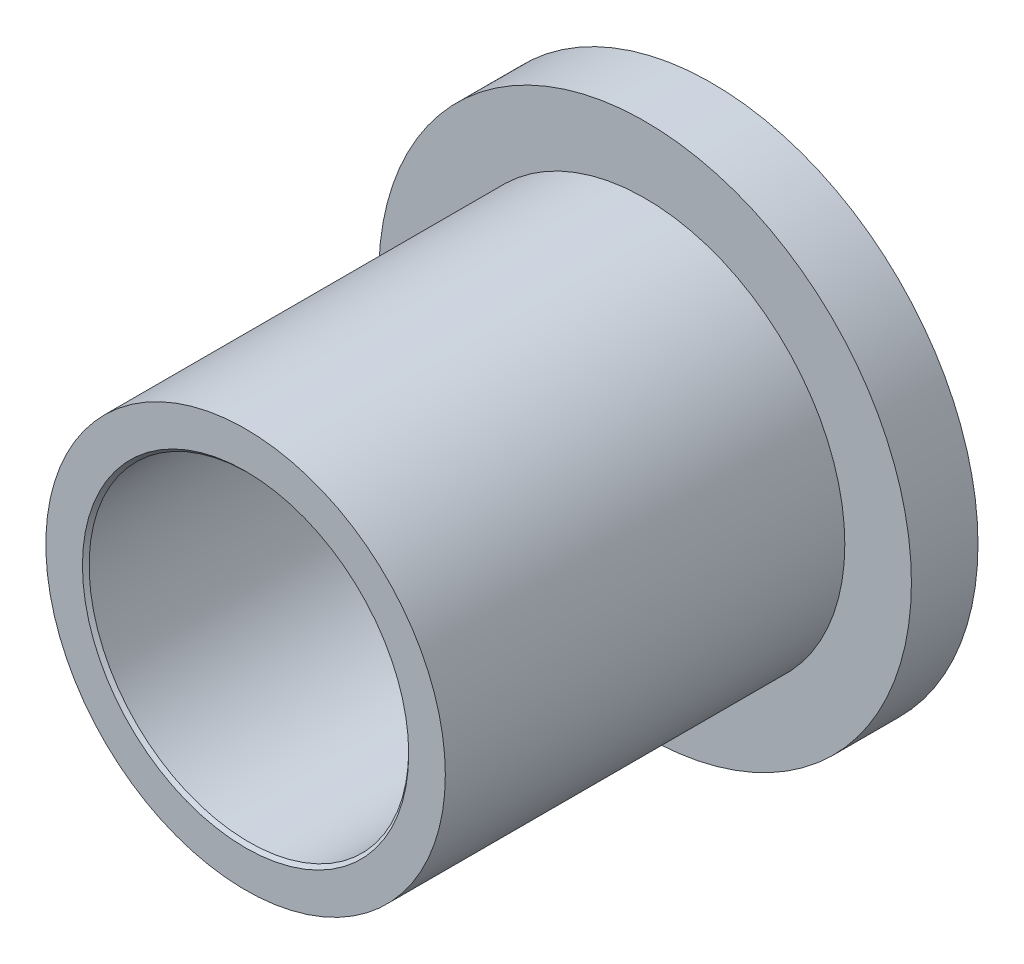
from build123d import *

# Parameters (mm, degrees)
SKETCH_1_R                   = 2
EXTRUDE_1_DEPTH              = 0.5
SKETCH_2_R                   = 1.5
EXTRUDE_2_DEPTH              = 3
HOLE_WIZARD_M2_1_D           = 2.4
HOLE_WIZARD_M2_1_CSINK_D     = 2.45
HOLE_WIZARD_M2_1_CSINK_ANGLE = 90


with BuildPart() as part:
    # 草图1 → 凸台-拉伸1 (new body)
    with BuildSketch(Plane.XY):
        Circle(SKETCH_1_R)
    extrude(amount=EXTRUDE_1_DEPTH)

    # 草图2 → 凸台-拉伸2 (add)
    with BuildSketch(Plane.XY.offset(0.5)):
        Circle(SKETCH_2_R)
    extrude(amount=EXTRUDE_2_DEPTH)

    # M2 间隙孔1 (through all)
    with Locations(Plane.XY.offset(3.5)):
        with Locations((0, 0)):
            CounterSinkHole(HOLE_WIZARD_M2_1_D / 2, HOLE_WIZARD_M2_1_CSINK_D / 2, counter_sink_angle=HOLE_WIZARD_M2_1_CSINK_ANGLE)


solid = part.part
